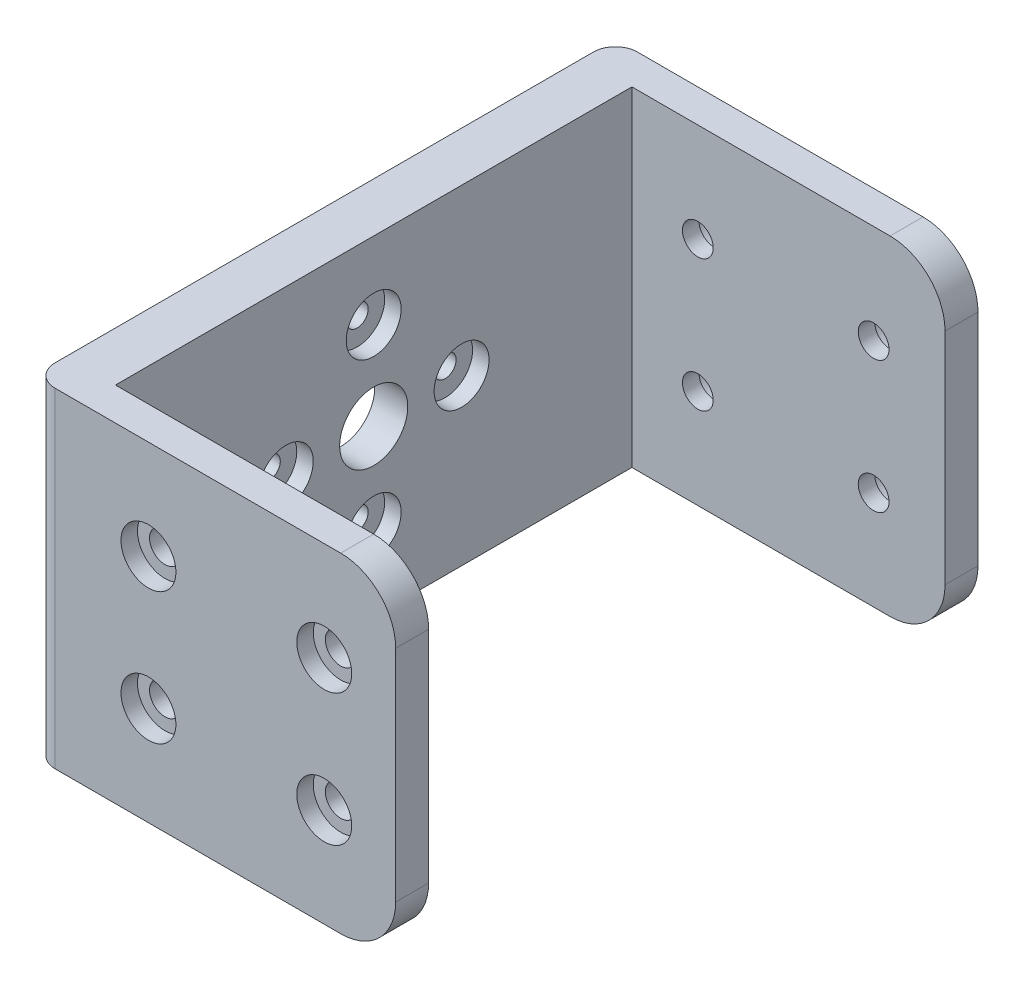
from build123d import *

# Parameters (mm, degrees)
BOSS_EXTRUDE1_DEPTH = 30
SKETCH2_R           = 1.4
CUT_EXTRUDE1_DEPTH  = 90.675732638
SKETCH3_R           = 2.5
CUT_EXTRUDE2_DEPTH  = 1.5
CUT_EXTRUDE3_START  = -1.5
SKETCH4_R           = 2.5
CUT_EXTRUDE3_DEPTH  = 1.5
SKETCH5_R           = 11.4
CUT_EXTRUDE4_DEPTH  = 1.5
SKETCH6_R           = 3.1
SKETCH6_R_2         = 1
CUT_EXTRUDE5_DEPTH  = 57.184338839
FILLET1_R           = 5
FILLET2_R           = 2
SKETCH7_R           = 2.5
CUT_EXTRUDE6_DEPTH  = 1.5


with BuildPart() as part:
    # Sketch1 → Boss-Extrude1 (new body)
    with BuildSketch(Plane(origin=(0, 0, 0), x_dir=(1, 0, 0), z_dir=(0, 1, 0))):
        Polygon((65.823529412, -35.558823529), (65.823529412, -32.558823529), (37.323529412, -32.558823529), (37.323529412, 14.441176471), (65.823529412, 14.441176471), (65.823529412, 17.441176471), (32.823529412, 17.441176471), (32.823529412, -35.558823529), align=None)
    extrude(amount=BOSS_EXTRUDE1_DEPTH)

    # Sketch2 → Cut-Extrude1 (cut, through all)
    with BuildSketch(Plane(origin=(0, 0, -17.441176471), x_dir=(-1, 0, 0), z_dir=(0, 0, -1))):
        with Locations((-59.323529412, 9)):
            Circle(SKETCH2_R)
        with Locations((-43.323529412, 9)):
            Circle(SKETCH2_R)
        with Locations((-43.323529412, 21)):
            Circle(SKETCH2_R)
        with Locations((-59.323529412, 21)):
            Circle(SKETCH2_R)
    extrude(amount=-CUT_EXTRUDE1_DEPTH, mode=Mode.SUBTRACT)

    # Sketch3 → Cut-Extrude2 (cut)
    with BuildSketch(Plane(origin=(0, 0, -17.441176471), x_dir=(-1, 0, 0), z_dir=(0, 0, -1))):
        with Locations((-59.323529412, 9)):
            Circle(SKETCH3_R)
        with Locations((-43.323529412, 9)):
            Circle(SKETCH3_R)
        with Locations((-43.323529412, 21)):
            Circle(SKETCH3_R)
        with Locations((-59.323529412, 21)):
            Circle(SKETCH3_R)
    extrude(amount=-CUT_EXTRUDE2_DEPTH, mode=Mode.SUBTRACT)

    # Sketch4 → Cut-Extrude3 (cut)
    with BuildSketch(Plane.XY.offset(35.558823529).offset(CUT_EXTRUDE3_START)):
        with Locations(Location((59.323529412, 21, 0), (0, 0, 180))):
            Circle(SKETCH4_R)
        with Locations(Location((43.323529412, 21, 0), (0, 0, 180))):
            Circle(SKETCH4_R)
        with Locations(Location((43.323529412, 9, 0), (0, 0, 180))):
            Circle(SKETCH4_R)
        with Locations(Location((59.323529412, 9, 0), (0, 0, 180))):
            Circle(SKETCH4_R)
    extrude(amount=CUT_EXTRUDE3_DEPTH, mode=Mode.SUBTRACT)

    # Sketch5 → Cut-Extrude4 (cut)
    with BuildSketch(Plane.ZY.offset(-32.823529412)):
        with Locations((9.058823529, 15)):
            Circle(SKETCH5_R)
    extrude(amount=-CUT_EXTRUDE4_DEPTH, mode=Mode.SUBTRACT)

    # Sketch6 → Cut-Extrude5 (cut, through all)
    with BuildSketch(Plane.ZY.offset(-34.323529412)):
        with Locations((9.058823529, 15)):
            Circle(SKETCH6_R)
        with Locations((1.058823529, 15)):
            Circle(SKETCH6_R_2)
        with Locations((9.058823529, 23)):
            Circle(SKETCH6_R_2)
        with Locations((17.058823529, 15)):
            Circle(SKETCH6_R_2)
        with Locations((9.058823529, 7)):
            Circle(SKETCH6_R_2)
    extrude(amount=-CUT_EXTRUDE5_DEPTH, mode=Mode.SUBTRACT)

    # Fillet1
    fillet1_edges = [part.edges().sort_by_distance(p)[0] for p in [
        (65.823529412, 0, 34.058823529),
        (65.823529412, 30, -15.941176471),
        (65.823529412, 30, 34.058823529),
        (65.823529412, 0, -15.941176471),
    ]]
    fillet(fillet1_edges, radius=FILLET1_R)

    # Fillet2
    fillet2_edges = [part.edges().sort_by_distance(p)[0] for p in [
        (32.823529412, 15, 35.558823529),
        (32.823529412, 15, -17.441176471),
    ]]
    fillet(fillet2_edges, radius=FILLET2_R)

    # Sketch7 → Cut-Extrude6 (cut)
    with BuildSketch(Plane(origin=(37.323529412, 0, 0), x_dir=(0, 0, -1), z_dir=(1, 0, 0))):
        with Locations((-17.058823529, 15)):
            Circle(SKETCH7_R)
        with Locations((-9.058823529, 23)):
            Circle(SKETCH7_R)
        with Locations((-1.058823529, 15)):
            Circle(SKETCH7_R)
        with Locations((-9.058823529, 7)):
            Circle(SKETCH7_R)
    extrude(amount=-CUT_EXTRUDE6_DEPTH, mode=Mode.SUBTRACT)


solid = part.part
